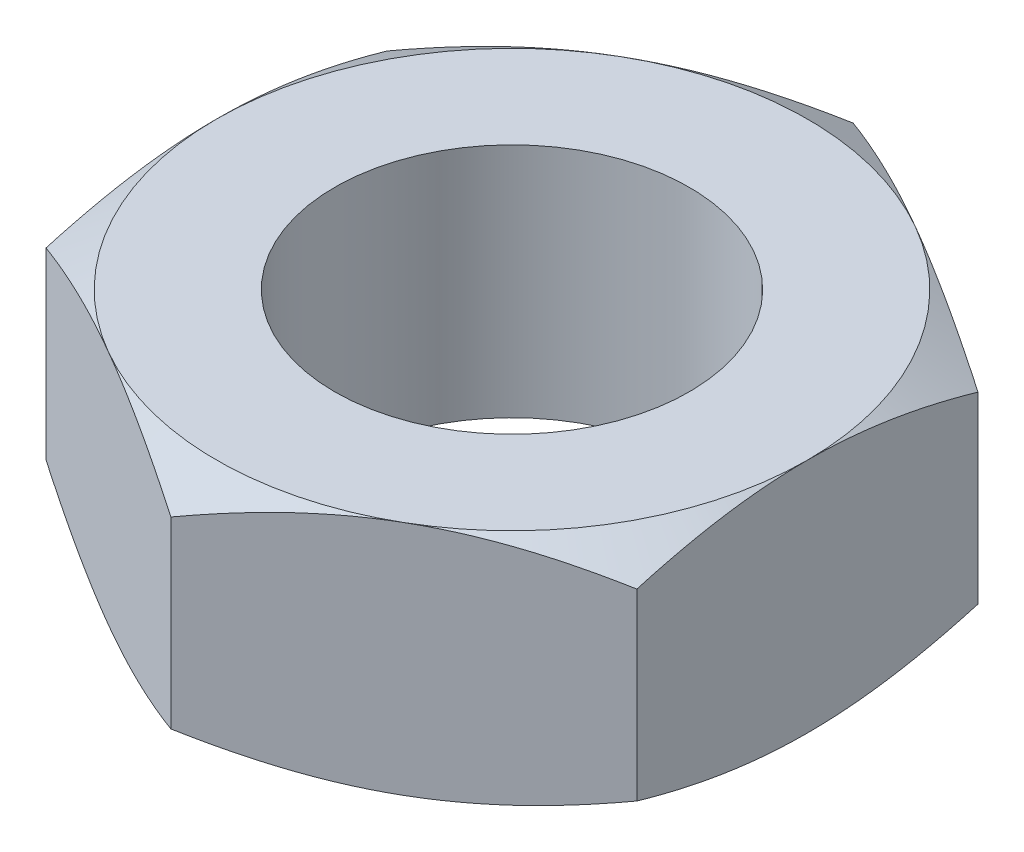
from build123d import *

# Parameters (mm, degrees)
SKETCH1_R           = 1.5
BOSS_EXTRUDE1_DEPTH = 2
SKETCH2_OUTSIDE_W   = 15.508
SKETCH2_OUTSIDE_H   = 16.282
SKETCH2_OUTSIDE_R   = 2.5
CUT_EXTRUDE1_DEPTH  = 2
CUT_EXTRUDE1_DRAFT  = -60
SKETCH3_OUTSIDE_W   = 15.508
SKETCH3_OUTSIDE_H   = 16.282
SKETCH3_OUTSIDE_R   = 2.5
CUT_EXTRUDE2_DEPTH  = 2
CUT_EXTRUDE2_DRAFT  = -60


with BuildPart() as part:
    # Sketch1 → Boss-Extrude1 (new body)
    with BuildSketch(Plane(origin=(0, 0, 0), x_dir=(1, 0, 0), z_dir=(0, 1, 0))):
        Polygon((0, 2.886751346), (-2.5, 1.443375673), (-2.5, -1.443375673), (0, -2.886751346), (2.5, -1.443375673), (2.5, 1.443375673), align=None)
        with Locations(Location((0, 0, 0), (0, 0, 270))):
            Circle(SKETCH1_R, mode=Mode.SUBTRACT)
    extrude(amount=BOSS_EXTRUDE1_DEPTH)


with BuildPart() as cut_extrude1_tool:
    # Sketch2 outside → Cut-Extrude1 (with draft: the straight prism first)
    with BuildSketch(Plane(origin=(0, 2, 0), x_dir=(1, 0, 0), z_dir=(0, 1, 0))):
        Rectangle(SKETCH2_OUTSIDE_W, SKETCH2_OUTSIDE_H)
        Circle(SKETCH2_OUTSIDE_R, mode=Mode.SUBTRACT)
    extrude(amount=-CUT_EXTRUDE1_DEPTH)
    # Cut-Extrude1: the draft: its side faces are tilted about the plane it starts from
    cut_extrude1_sides = [cut_extrude1_tool.faces().sort_by_distance(p)[0] for p in [
        (0, 1, 8.141),
        (7.754, 1, 0),
        (0, 1, -8.141),
        (-7.754, 1, 0),
        (-2.5, 1, 0),
    ]]
    draft(cut_extrude1_sides, Plane(origin=(0, 2, 0), x_dir=(1, 0, 0), z_dir=(0, 1, 0)), CUT_EXTRUDE1_DRAFT)


with BuildPart() as part_1:
    add(part.part)

    # Cut-Extrude1: cut by cut_extrude1_tool
    add(cut_extrude1_tool.part, mode=Mode.SUBTRACT)


with BuildPart() as cut_extrude2_tool:
    # Sketch3 outside → Cut-Extrude2 (with draft: the straight prism first)
    with BuildSketch(Plane.XZ):
        Rectangle(SKETCH3_OUTSIDE_W, SKETCH3_OUTSIDE_H)
        Circle(SKETCH3_OUTSIDE_R, mode=Mode.SUBTRACT)
    extrude(amount=-CUT_EXTRUDE2_DEPTH)
    # Cut-Extrude2: the draft: its side faces are tilted about the plane it starts from
    cut_extrude2_sides = [cut_extrude2_tool.faces().sort_by_distance(p)[0] for p in [
        (0, 1, -8.141),
        (7.754, 1, 0),
        (0, 1, 8.141),
        (-7.754, 1, 0),
        (-2.5, 1, 0),
    ]]
    draft(cut_extrude2_sides, Plane.XZ, CUT_EXTRUDE2_DRAFT)


with BuildPart() as part_2:
    add(part_1.part)

    # Cut-Extrude2: cut by cut_extrude2_tool
    add(cut_extrude2_tool.part, mode=Mode.SUBTRACT)


solid = part_2.part
